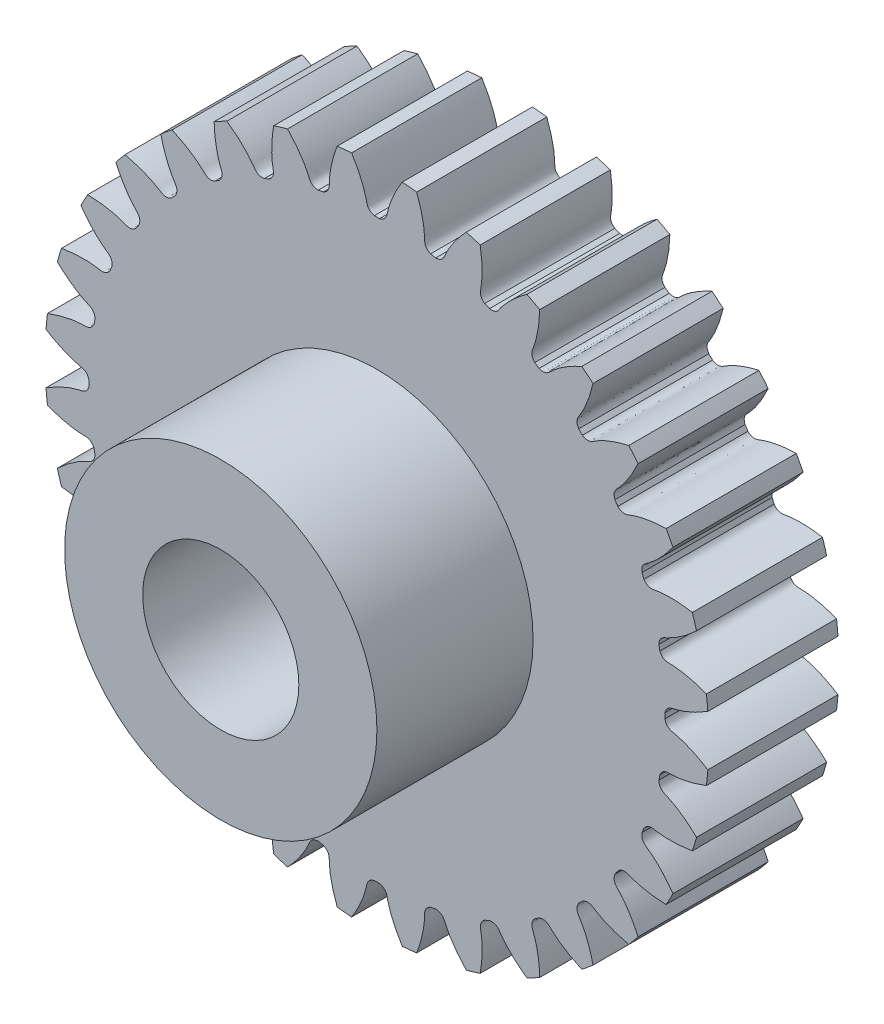
from build123d import *

# Parameters (mm, degrees)
SKETCH_1_R               = 12.75
EXTRUDE_1_DEPTH          = 5
CUT_EXTRUDE_1_DEPTH      = 19.711627401
PATTERN_CIRCULAR_1_COUNT = 32
SKETCH_4_R               = 6
EXTRUDE_2_DEPTH          = 6
SKETCH_5_R               = 3
CUT_EXTRUDE_2_DEPTH      = 22.076858228


with BuildPart() as part:
    # 草图1 → 凸台-拉伸1 (new body)
    with BuildSketch(Plane.XY):
        Circle(SKETCH_1_R)
    extrude(amount=EXTRUDE_1_DEPTH)

    # 草图2 → 切除-拉伸1 (cut, through all)
    with BuildSketch(Plane.XY):
        with BuildLine():
            ThreePointArc((0.100524085, 11.062043263), (0, 11.0625), (-0.100524085, 11.062043263))
            add(Edge.make_bspline(
                [(-0.100524085, 11.062043263), (-0.366614628, 11.126377807), (-0.381278132, 11.319309938), (-0.43007149, 11.520571539), (-0.442774587, 11.56902123), (-0.457693024, 11.621539316), (-0.474970095, 11.678065069), (-0.494778825, 11.738520326), (-0.517280541, 11.802825654), (-0.542637215, 11.870895542), (-0.571007597, 11.942639912), (-0.602548192, 12.017963749), (-0.637412803, 12.096767292), (-0.675752501, 12.178946066), (-0.717715466, 12.264390963), (-0.763446876, 12.352988311), (-0.813088777, 12.444619957), (-0.866779967, 12.539163343), (-0.924655871, 12.636491591), (-0.986848431, 12.736473587), (-1.053485987, 12.838974076), (-1.124693164, 12.943853748), (-1.200590765, 13.050969337), (-1.281295659, 13.160173715), (-1.366920678, 13.271315998), (-1.457574512, 13.384241645), (-1.553361613, 13.498792565), (-1.654382088, 13.614807225), (-1.760731613, 13.732120763), (-1.872501333, 13.850565097), (-1.989777785, 13.969969047), (-2.112642765, 14.090158447), (-2.286208249, 14.253281652), (-2.421747973, 14.373127494), (-2.514774403, 14.452205176)],
                knots=[0, 0, 0, 0, 0.124532679, 0.135328735, 0.147193327, 0.160126453, 0.174128116, 0.189198313, 0.205337046, 0.222544314, 0.240820117, 0.260164456, 0.28057733, 0.302058739, 0.324608684, 0.348227164, 0.372914179, 0.39866973, 0.425493816, 0.453386438, 0.482347595, 0.512377287, 0.543475514, 0.575642277, 0.608877575, 0.643181408, 0.678553777, 0.714994681, 0.752504121, 0.791082096, 0.830728606, 0.871443651, 0.913227232, 1, 1, 1, 1], degree=3))
            ThreePointArc((-2.514774403, 14.452205176), (0, 14.669366883), (2.514774403, 14.452205176))
            add(Edge.make_bspline(
                [(0.100524085, 11.062043263), (0.366614628, 11.126377807), (0.381278132, 11.319309938), (0.43007149, 11.520571539), (0.442774587, 11.56902123), (0.457693024, 11.621539316), (0.474970095, 11.678065069), (0.494778825, 11.738520326), (0.517280541, 11.802825654), (0.542637215, 11.870895542), (0.571007597, 11.942639912), (0.602548192, 12.017963749), (0.637412803, 12.096767292), (0.675752501, 12.178946066), (0.717715466, 12.264390963), (0.763446876, 12.352988311), (0.813088777, 12.444619957), (0.866779967, 12.539163343), (0.924655871, 12.636491591), (0.986848431, 12.736473587), (1.053485987, 12.838974076), (1.124693164, 12.943853748), (1.200590765, 13.050969337), (1.281295659, 13.160173715), (1.366920678, 13.271315998), (1.457574512, 13.384241645), (1.553361613, 13.498792565), (1.654382088, 13.614807225), (1.760731613, 13.732120763), (1.872501333, 13.850565097), (1.989777785, 13.969969047), (2.112642765, 14.090158447), (2.286208249, 14.253281652), (2.421747973, 14.373127494), (2.514774403, 14.452205176)],
                knots=[0, 0, 0, 0, 0.124532679, 0.135328735, 0.147193327, 0.160126453, 0.174128116, 0.189198313, 0.205337046, 0.222544314, 0.240820117, 0.260164456, 0.28057733, 0.302058739, 0.324608684, 0.348227164, 0.372914179, 0.39866973, 0.425493816, 0.453386438, 0.482347595, 0.512377287, 0.543475514, 0.575642277, 0.608877575, 0.643181408, 0.678553777, 0.714994681, 0.752504121, 0.791082096, 0.830728606, 0.871443651, 0.913227232, 1, 1, 1, 1], degree=3))
        make_face()
    cut_extrude_1 = extrude(amount=CUT_EXTRUDE_1_DEPTH, mode=Mode.SUBTRACT)

    # 阵列(圆周)1: 切除-拉伸1 ×32 about axis
    pattern_circular_1_axis = Axis((0, 0, -0.25), (0, 0, 1))
    for i in range(1, PATTERN_CIRCULAR_1_COUNT):
        add(cut_extrude_1.rotate(pattern_circular_1_axis, i * 360 / PATTERN_CIRCULAR_1_COUNT), mode=Mode.SUBTRACT)

    # 草图4 → 凸台-拉伸2 (add)
    with BuildSketch(Plane.XY.offset(5)):
        Circle(SKETCH_4_R)
    extrude(amount=EXTRUDE_2_DEPTH)

    # 草图5 → 切除-拉伸2 (cut, through all)
    with BuildSketch(Plane.XY.offset(11)):
        Circle(SKETCH_5_R)
    extrude(amount=-CUT_EXTRUDE_2_DEPTH, mode=Mode.SUBTRACT)


solid = part.part
